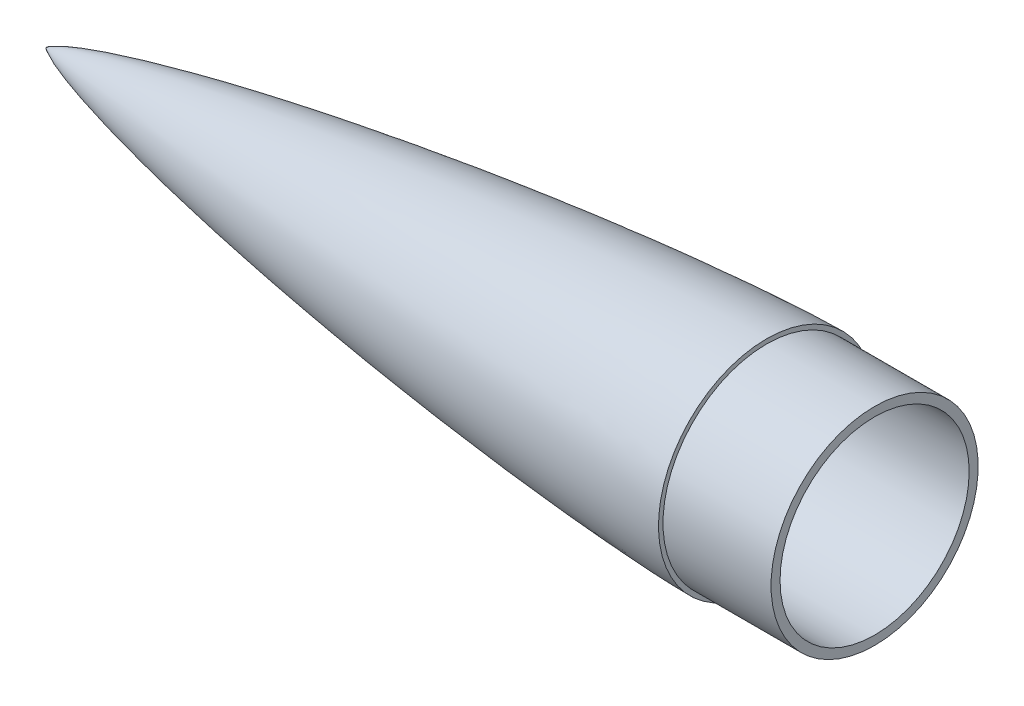
from build123d import *


with BuildPart() as part:
    # Sketch8 → Revolve8 (revolve)
    with BuildSketch(Plane.XY):
        with BuildLine():
            Line((482.6, 72.121373613), (482.6, 66.675))
            Line((482.6, 66.675), (584.2, 66.675))
            Line((584.2, 66.675), (584.2, 73.025))
            Line((584.2, 73.025), (508, 73.025))
            Line((508, 73.025), (508, 76.2))
            add(Edge.make_bspline(
                [(0, 0), (0.002894819, 0.011115155), (0.01034245, 0.032683563), (0.032155098, 0.073071529), (0.071013818, 0.129690141), (0.121062521, 0.192173081), (0.192516213, 0.271316909), (0.278565167, 0.357446844), (0.407369802, 0.475720046), (0.610266758, 0.644634608), (0.924072548, 0.880503514), (1.456114844, 1.239242613), (2.353369073, 1.77779001), (3.932084886, 2.614953974), (6.811128094, 3.950333367), (11.981546295, 6.02815512), (20.595338665, 9.015886771), (32.214634419, 12.518551256), (46.169453784, 16.279617461), (65.413303868, 21.011927392), (88.685436406, 26.196381251), (116.150288019, 31.751833345), (147.819105397, 37.572140277), (179.568799657, 42.931176289), (211.383441581, 47.889000609), (243.252504522, 52.483098583), (275.168941175, 56.735288827), (307.127725566, 60.656273162), (339.125337213, 64.246849075), (371.159282781, 67.497761321), (403.227930278, 70.387661186), (431.317558536, 72.565721954), (455.415374533, 74.137806222), (474.544694142, 75.153522309), (487.168366139, 75.693659471), (497.302022237, 76.021344299), (503.414709527, 76.152594056), (506.471494958, 76.194567579), (508, 76.2)],
                knots=[0, 0, 0, 0, 0, 8.8671e-05, 0.000177341, 0.000354682, 0.000532024, 0.000709365, 0.00100412, 0.001298875, 0.001888194, 0.002756681, 0.004048247, 0.006274892, 0.010002863, 0.016613316, 0.028658082, 0.04948617, 0.080709186, 0.11073877, 0.140768354, 0.203214532, 0.265660702, 0.328106876, 0.390553052, 0.452999227, 0.515445401, 0.577891576, 0.640337751, 0.702783926, 0.7652301, 0.827676277, 0.890122452, 0.921345539, 0.952568627, 0.976284313, 0.988142157, 1, 1, 1, 1, 1], degree=4))
            Line((0, 0), (6.35, 0))
            add(Edge.make_bspline(
                [(6.35, 0), (8.798676823, 0.907287755), (13.72736288, 2.603181979), (23.764289673, 5.746093846), (36.451419919, 9.310808775), (51.806463094, 13.230768343), (72.38805053, 18.098925611), (98.258090877, 23.660806695), (129.440077613, 29.739574434), (160.721248612, 35.339734657), (202.530658258, 42.263190289), (254.945283706, 50.013825987), (318.02156812, 58.040436828), (370.706818604, 63.678212698), (412.91597, 67.484067624), (444.601987404, 69.938180449), (467.833322743, 71.390674128), (480.503445442, 72.021795296), (482.6, 72.121373613)],
                knots=[0.027271759, 0.027271759, 0.027271759, 0.027271759, 0.042372952, 0.057474145, 0.087676531, 0.117878917, 0.148081302, 0.208486074, 0.268890845, 0.329295617, 0.389700388, 0.510509931, 0.631319474, 0.752129017, 0.812533788, 0.87293856, 0.933343331, 0.945322529, 0.945322529, 0.945322529, 0.945322529], degree=3))
        make_face()
    revolve(axis=Axis((508, 0, 0), (-1, 0, 0)))


solid = part.part
